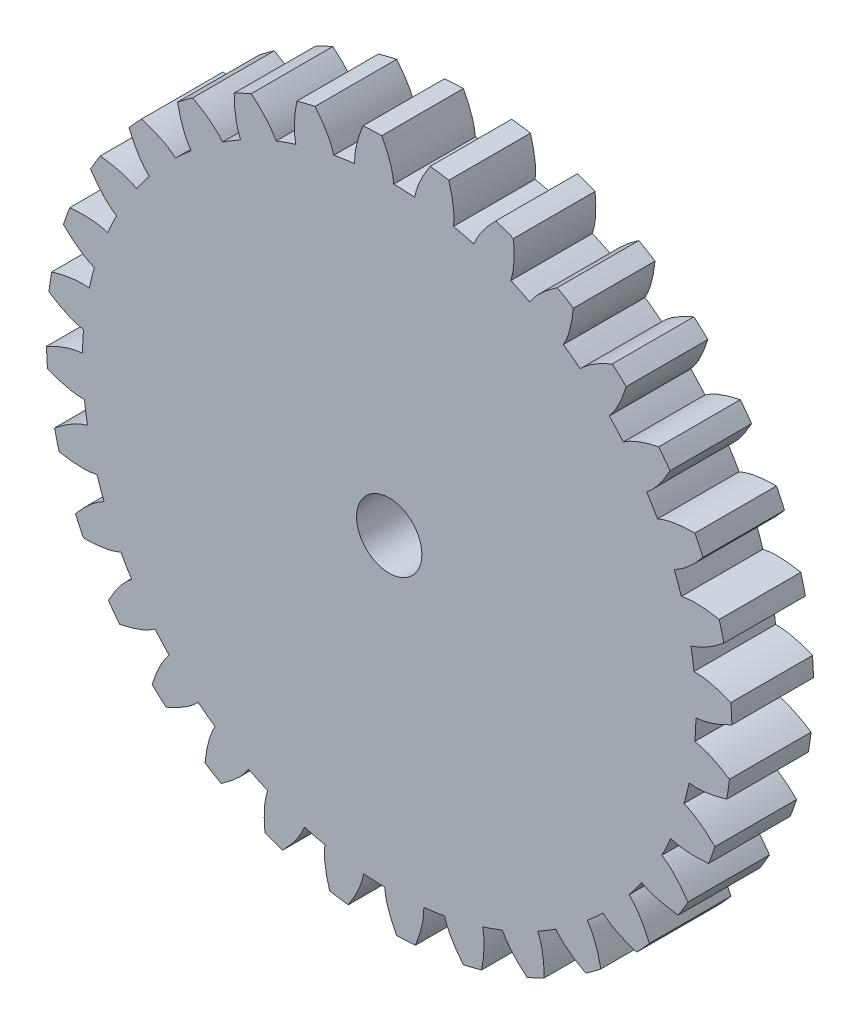
from build123d import *

# Parameters (mm, degrees)
BOSS_EXTRUDE7_DEPTH = 1
CIRPATTERN1_COUNT   = 32
DIAMETRO_BASE_R     = 3.758770483
BOSS_EXTRUDE9_DEPTH = 1
MOZZO_R             = 0.4
CUT_EXTRUDE1_DEPTH  = 1
SKETCH1_R           = 4.25
SKETCH1_R_2         = 4.2
CUT_EXTRUDE2_DEPTH  = 7.090787907


with BuildPart() as part:
    # profilo → Boss-Extrude7 (new body)
    with BuildSketch(Plane.XY):
        with BuildLine():
            Line((-0.208537616, 4.244880689), (-0.184434126, 3.754242879))
            ThreePointArc((-0.184434126, 3.754242879), (-0.064239901, 3.758221492), (0.056020084, 3.758353003))
            add(Edge.make_bspline(
                [(-0.116842984, 4.248393545), (-0.034075941, 4.096076065), (0.042378759, 3.933500457), (0.056020084, 3.758353003)],
                knots=[0.080011926, 0.080011926, 0.080011926, 0.080011926, 1, 1, 1, 1], degree=3))
            ThreePointArc((-0.116842984, 4.248393545), (-0.162699781, 4.246884597), (-0.208537616, 4.244880689))
        make_face()
    extrude(amount=BOSS_EXTRUDE7_DEPTH)

    # Mirror1: part across plane


with BuildPart() as part_1:
    add(part.part)
    add(part.part.mirror(Plane(origin=(0, 0, 0), x_dir=(0, 0, 1), z_dir=(0.9987954562051725, 0.049067674327418105, 0))))


with BuildPart() as cirpattern1_1:
    # CirPattern1: pattern copy
    add(part_1.part.rotate(Axis((0, 0, 0), (0, 0, -1)), 1 * 360 / CIRPATTERN1_COUNT))


with BuildPart() as cirpattern1_2:
    # CirPattern1: pattern copy
    add(part_1.part.rotate(Axis((0, 0, 0), (0, 0, -1)), 2 * 360 / CIRPATTERN1_COUNT))


with BuildPart() as cirpattern1_3:
    # CirPattern1: pattern copy
    add(part_1.part.rotate(Axis((0, 0, 0), (0, 0, -1)), 3 * 360 / CIRPATTERN1_COUNT))


with BuildPart() as cirpattern1_4:
    # CirPattern1: pattern copy
    add(part_1.part.rotate(Axis((0, 0, 0), (0, 0, -1)), 4 * 360 / CIRPATTERN1_COUNT))


with BuildPart() as cirpattern1_5:
    # CirPattern1: pattern copy
    add(part_1.part.rotate(Axis((0, 0, 0), (0, 0, -1)), 5 * 360 / CIRPATTERN1_COUNT))


with BuildPart() as cirpattern1_6:
    # CirPattern1: pattern copy
    add(part_1.part.rotate(Axis((0, 0, 0), (0, 0, -1)), 6 * 360 / CIRPATTERN1_COUNT))


with BuildPart() as cirpattern1_7:
    # CirPattern1: pattern copy
    add(part_1.part.rotate(Axis((0, 0, 0), (0, 0, -1)), 7 * 360 / CIRPATTERN1_COUNT))


with BuildPart() as cirpattern1_8:
    # CirPattern1: pattern copy
    add(part_1.part.rotate(Axis((0, 0, 0), (0, 0, -1)), 8 * 360 / CIRPATTERN1_COUNT))


with BuildPart() as cirpattern1_9:
    # CirPattern1: pattern copy
    add(part_1.part.rotate(Axis((0, 0, 0), (0, 0, -1)), 9 * 360 / CIRPATTERN1_COUNT))


with BuildPart() as cirpattern1_10:
    # CirPattern1: pattern copy
    add(part_1.part.rotate(Axis((0, 0, 0), (0, 0, -1)), 10 * 360 / CIRPATTERN1_COUNT))


with BuildPart() as cirpattern1_11:
    # CirPattern1: pattern copy
    add(part_1.part.rotate(Axis((0, 0, 0), (0, 0, -1)), 11 * 360 / CIRPATTERN1_COUNT))


with BuildPart() as cirpattern1_12:
    # CirPattern1: pattern copy
    add(part_1.part.rotate(Axis((0, 0, 0), (0, 0, -1)), 12 * 360 / CIRPATTERN1_COUNT))


with BuildPart() as cirpattern1_13:
    # CirPattern1: pattern copy
    add(part_1.part.rotate(Axis((0, 0, 0), (0, 0, -1)), 13 * 360 / CIRPATTERN1_COUNT))


with BuildPart() as cirpattern1_14:
    # CirPattern1: pattern copy
    add(part_1.part.rotate(Axis((0, 0, 0), (0, 0, -1)), 14 * 360 / CIRPATTERN1_COUNT))


with BuildPart() as cirpattern1_15:
    # CirPattern1: pattern copy
    add(part_1.part.rotate(Axis((0, 0, 0), (0, 0, -1)), 15 * 360 / CIRPATTERN1_COUNT))


with BuildPart() as cirpattern1_16:
    # CirPattern1: pattern copy
    add(part_1.part.rotate(Axis((0, 0, 0), (0, 0, -1)), 16 * 360 / CIRPATTERN1_COUNT))


with BuildPart() as cirpattern1_17:
    # CirPattern1: pattern copy
    add(part_1.part.rotate(Axis((0, 0, 0), (0, 0, -1)), 17 * 360 / CIRPATTERN1_COUNT))


with BuildPart() as cirpattern1_18:
    # CirPattern1: pattern copy
    add(part_1.part.rotate(Axis((0, 0, 0), (0, 0, -1)), 18 * 360 / CIRPATTERN1_COUNT))


with BuildPart() as cirpattern1_19:
    # CirPattern1: pattern copy
    add(part_1.part.rotate(Axis((0, 0, 0), (0, 0, -1)), 19 * 360 / CIRPATTERN1_COUNT))


with BuildPart() as cirpattern1_20:
    # CirPattern1: pattern copy
    add(part_1.part.rotate(Axis((0, 0, 0), (0, 0, -1)), 20 * 360 / CIRPATTERN1_COUNT))


with BuildPart() as cirpattern1_21:
    # CirPattern1: pattern copy
    add(part_1.part.rotate(Axis((0, 0, 0), (0, 0, -1)), 21 * 360 / CIRPATTERN1_COUNT))


with BuildPart() as cirpattern1_22:
    # CirPattern1: pattern copy
    add(part_1.part.rotate(Axis((0, 0, 0), (0, 0, -1)), 22 * 360 / CIRPATTERN1_COUNT))


with BuildPart() as cirpattern1_23:
    # CirPattern1: pattern copy
    add(part_1.part.rotate(Axis((0, 0, 0), (0, 0, -1)), 23 * 360 / CIRPATTERN1_COUNT))


with BuildPart() as cirpattern1_24:
    # CirPattern1: pattern copy
    add(part_1.part.rotate(Axis((0, 0, 0), (0, 0, -1)), 24 * 360 / CIRPATTERN1_COUNT))


with BuildPart() as cirpattern1_25:
    # CirPattern1: pattern copy
    add(part_1.part.rotate(Axis((0, 0, 0), (0, 0, -1)), 25 * 360 / CIRPATTERN1_COUNT))


with BuildPart() as cirpattern1_26:
    # CirPattern1: pattern copy
    add(part_1.part.rotate(Axis((0, 0, 0), (0, 0, -1)), 26 * 360 / CIRPATTERN1_COUNT))


with BuildPart() as cirpattern1_27:
    # CirPattern1: pattern copy
    add(part_1.part.rotate(Axis((0, 0, 0), (0, 0, -1)), 27 * 360 / CIRPATTERN1_COUNT))


with BuildPart() as cirpattern1_28:
    # CirPattern1: pattern copy
    add(part_1.part.rotate(Axis((0, 0, 0), (0, 0, -1)), 28 * 360 / CIRPATTERN1_COUNT))


with BuildPart() as cirpattern1_29:
    # CirPattern1: pattern copy
    add(part_1.part.rotate(Axis((0, 0, 0), (0, 0, -1)), 29 * 360 / CIRPATTERN1_COUNT))


with BuildPart() as cirpattern1_30:
    # CirPattern1: pattern copy
    add(part_1.part.rotate(Axis((0, 0, 0), (0, 0, -1)), 30 * 360 / CIRPATTERN1_COUNT))


with BuildPart() as cirpattern1_31:
    # CirPattern1: pattern copy
    add(part_1.part.rotate(Axis((0, 0, 0), (0, 0, -1)), 31 * 360 / CIRPATTERN1_COUNT))


with BuildPart() as part_2:
    add(part_1.part)

    add(cirpattern1_1.part)  # Boss-Extrude9 merges CirPattern1_1

    add(cirpattern1_2.part)  # Boss-Extrude9 merges CirPattern1_2

    add(cirpattern1_3.part)  # Boss-Extrude9 merges CirPattern1_3

    add(cirpattern1_4.part)  # Boss-Extrude9 merges CirPattern1_4

    add(cirpattern1_5.part)  # Boss-Extrude9 merges CirPattern1_5

    add(cirpattern1_6.part)  # Boss-Extrude9 merges CirPattern1_6

    add(cirpattern1_7.part)  # Boss-Extrude9 merges CirPattern1_7

    add(cirpattern1_8.part)  # Boss-Extrude9 merges CirPattern1_8

    add(cirpattern1_9.part)  # Boss-Extrude9 merges CirPattern1_9

    add(cirpattern1_10.part)  # Boss-Extrude9 merges CirPattern1_10

    add(cirpattern1_11.part)  # Boss-Extrude9 merges CirPattern1_11

    add(cirpattern1_12.part)  # Boss-Extrude9 merges CirPattern1_12

    add(cirpattern1_13.part)  # Boss-Extrude9 merges CirPattern1_13

    add(cirpattern1_14.part)  # Boss-Extrude9 merges CirPattern1_14

    add(cirpattern1_15.part)  # Boss-Extrude9 merges CirPattern1_15

    add(cirpattern1_16.part)  # Boss-Extrude9 merges CirPattern1_16

    add(cirpattern1_17.part)  # Boss-Extrude9 merges CirPattern1_17

    add(cirpattern1_18.part)  # Boss-Extrude9 merges CirPattern1_18

    add(cirpattern1_19.part)  # Boss-Extrude9 merges CirPattern1_19

    add(cirpattern1_20.part)  # Boss-Extrude9 merges CirPattern1_20

    add(cirpattern1_21.part)  # Boss-Extrude9 merges CirPattern1_21

    add(cirpattern1_22.part)  # Boss-Extrude9 merges CirPattern1_22

    add(cirpattern1_23.part)  # Boss-Extrude9 merges CirPattern1_23

    add(cirpattern1_24.part)  # Boss-Extrude9 merges CirPattern1_24

    add(cirpattern1_25.part)  # Boss-Extrude9 merges CirPattern1_25

    add(cirpattern1_26.part)  # Boss-Extrude9 merges CirPattern1_26

    add(cirpattern1_27.part)  # Boss-Extrude9 merges CirPattern1_27

    add(cirpattern1_28.part)  # Boss-Extrude9 merges CirPattern1_28

    add(cirpattern1_29.part)  # Boss-Extrude9 merges CirPattern1_29

    add(cirpattern1_30.part)  # Boss-Extrude9 merges CirPattern1_30

    add(cirpattern1_31.part)  # Boss-Extrude9 merges CirPattern1_31
    # diametro base → Boss-Extrude9 (add)
    with BuildSketch(Plane.XY):
        Circle(DIAMETRO_BASE_R)
    extrude(amount=BOSS_EXTRUDE9_DEPTH)

    # mozzo → Cut-Extrude1 (cut)
    with BuildSketch(Plane.XY):
        Circle(MOZZO_R)
    extrude(amount=CUT_EXTRUDE1_DEPTH, mode=Mode.SUBTRACT)

    # Sketch1 → Cut-Extrude2 (cut, through all)
    with BuildSketch(Plane.XY.offset(1)):
        Circle(SKETCH1_R)
        Circle(SKETCH1_R_2, mode=Mode.SUBTRACT)
    extrude(amount=-CUT_EXTRUDE2_DEPTH, mode=Mode.SUBTRACT)


solid = part_2.part
